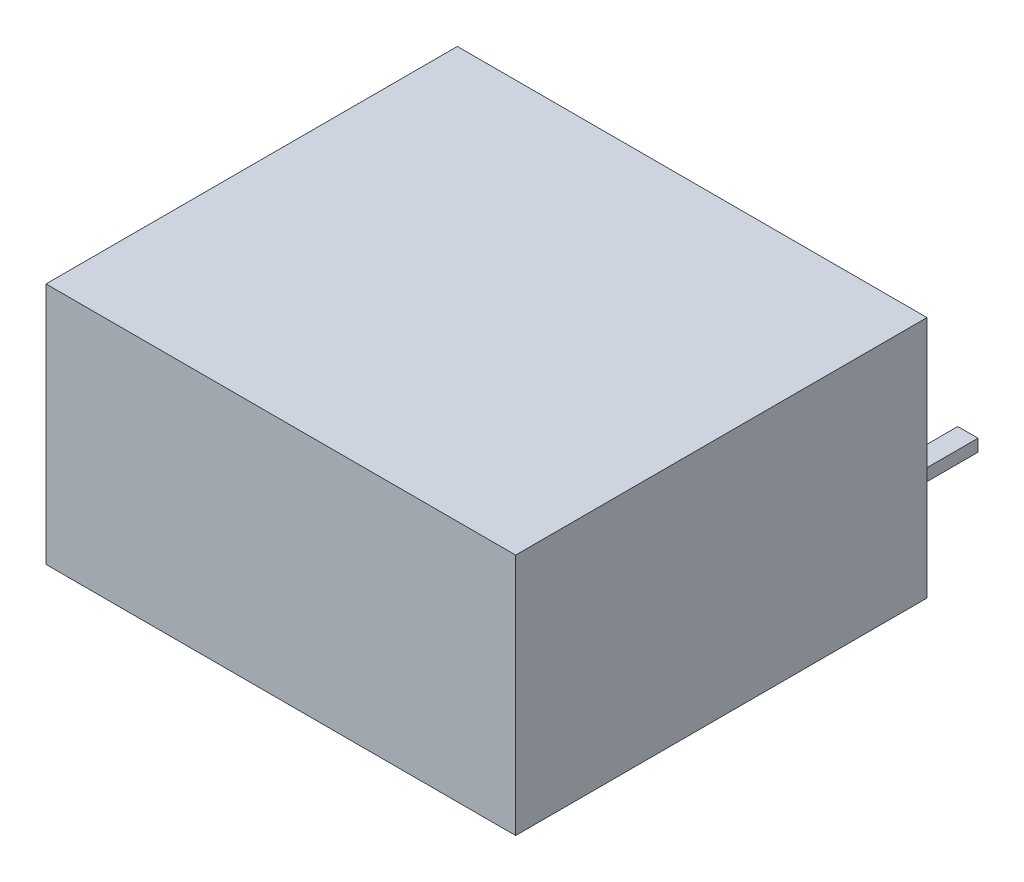
from build123d import *

# Parameters (mm, degrees)
SKETCH_1_W               = 11.6
SKETCH_1_H               = 6
EXTRUDE_1_DEPTH          = 10.16
SKETCH_2_W               = 0.5
SKETCH_2_H               = 0.3
EXTRUDE_2_DEPTH          = 3
PATTERN_LINEAR_1_COUNT   = 2
PATTERN_LINEAR_1_PITCH   = 2.54
PATTERN_LINEAR_1_2_COUNT = 3
PATTERN_LINEAR_1_2_PITCH = 2.54


with BuildPart() as part:
    # Эскиз1 → Бобышка-Вытянуть1 (new body)
    with BuildSketch(Plane.XY):
        Rectangle(SKETCH_1_W, SKETCH_1_H)
    extrude(amount=EXTRUDE_1_DEPTH)


with BuildPart() as body_2:
    # Эскиз2 → Бобышка-Вытянуть2 (new body)
    with BuildSketch(Plane(origin=(0, 0, 0), x_dir=(-1, 0, 0), z_dir=(0, 0, -1))):
        with Locations((1.27, -2.1)):
            Rectangle(SKETCH_2_W, SKETCH_2_H)
    extrude(amount=EXTRUDE_2_DEPTH)


with BuildPart() as pattern_linear_1_1:
    # Линейный массив1: pattern copy
    add(body_2.part.moved(Location(Vector(-1, 0, 0) * (1 * PATTERN_LINEAR_1_PITCH))))


with BuildPart() as pattern_linear_1_2_1:
    # Pattern Linear 1 2: pattern copy
    add(body_2.part.moved(Location(Vector(1, 0, 0) * (1 * PATTERN_LINEAR_1_2_PITCH))))


with BuildPart() as pattern_linear_1_2_2:
    # Pattern Linear 1 2: pattern copy
    add(body_2.part.moved(Location(Vector(1, 0, 0) * (2 * PATTERN_LINEAR_1_2_PITCH))))


with BuildPart() as pattern_linear_1_2_3:
    # Pattern Linear 1 2: pattern copy
    add(pattern_linear_1_1.part.moved(Location(Vector(1, 0, 0) * (1 * PATTERN_LINEAR_1_2_PITCH))))


with BuildPart() as pattern_linear_1_2_4:
    # Pattern Linear 1 2: pattern copy
    add(pattern_linear_1_1.part.moved(Location(Vector(1, 0, 0) * (2 * PATTERN_LINEAR_1_2_PITCH))))


solid = Compound([part.part, body_2.part, pattern_linear_1_1.part, pattern_linear_1_2_1.part, pattern_linear_1_2_2.part, pattern_linear_1_2_3.part, pattern_linear_1_2_4.part])
